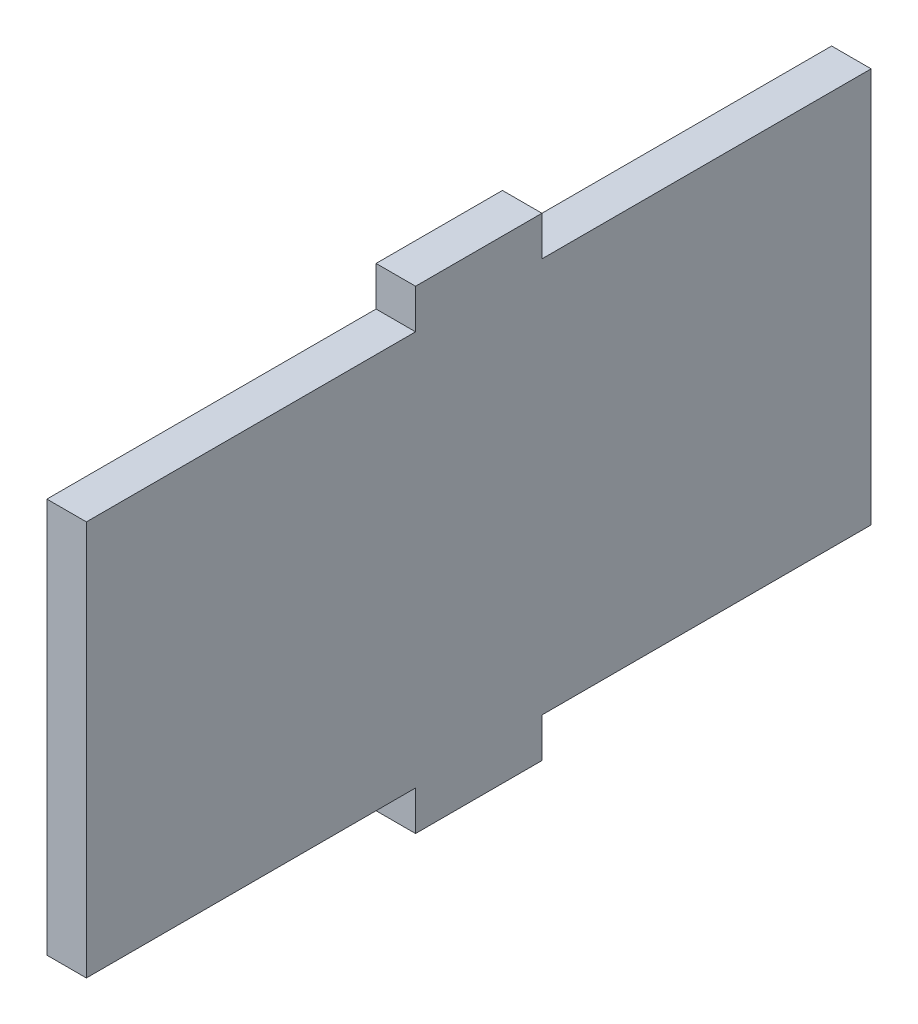
from build123d import *

# Parameters (mm, degrees)
BOSS_EXTRUDE1_DEPTH = 3


with BuildPart() as part:
    # Sketch1 → Boss-Extrude1 (new body)
    with BuildSketch(Plane(origin=(0, 0, 0), x_dir=(0, 0, -1), z_dir=(1, 0, 0))):
        Polygon((4.8, 41), (4.8, 38), (29.8, 38), (29.8, 8), (4.8, 8), (4.8, 5), (-4.8, 5), (-4.8, 8), (-29.8, 8), (-29.8, 38), (-4.8, 38), (-4.8, 41), align=None)
    extrude(amount=BOSS_EXTRUDE1_DEPTH)


solid = part.part
